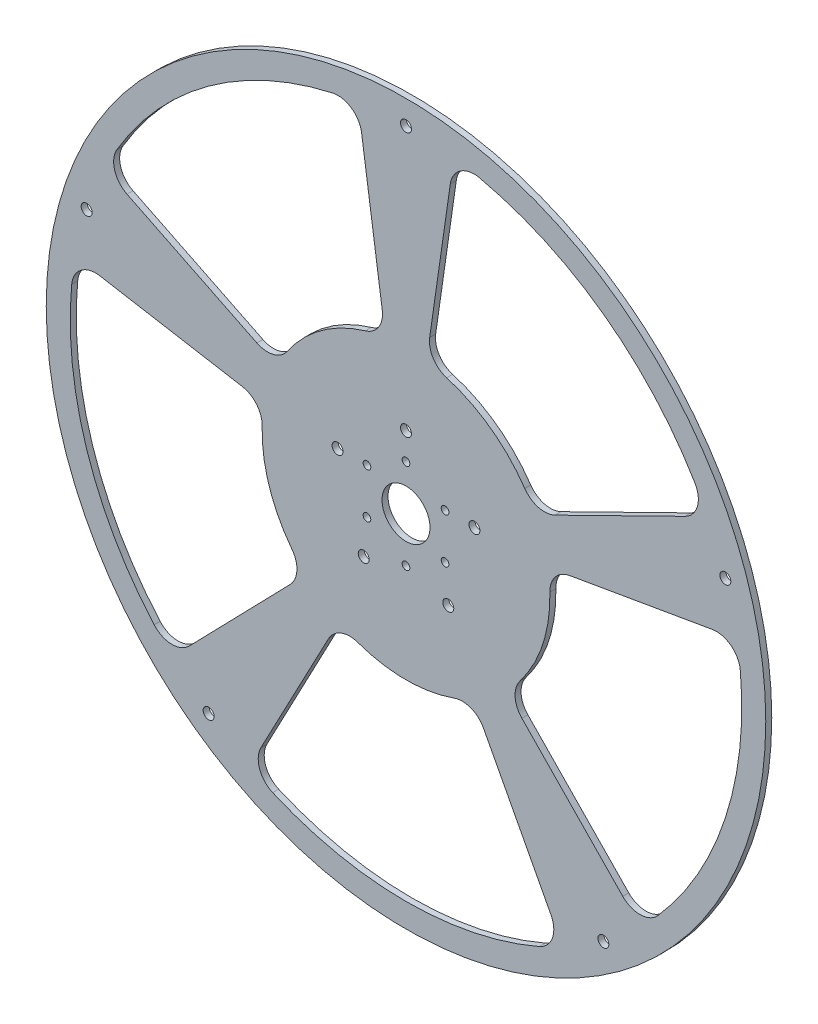
from build123d import *

# Parameters (mm, degrees)
SKETCH1_R           = 190.5
SKETCH1_R_2         = 12.7
SKETCH1_R_3         = 2.9
SKETCH1_R_4         = 2.032
BOSS_EXTRUDE3_DEPTH = 3.175
FILLET1_R           = 12.7
FILLET2_R           = 12.7
FILLET3_R           = 12.7


with BuildPart() as part:
    # Sketch1 → Boss-Extrude3 (new body)
    with BuildSketch(Plane.XY):
        Circle(SKETCH1_R)
        Circle(SKETCH1_R_2, mode=Mode.SUBTRACT)
        with Locations((-36.235253271, 11.773547486)):
            Circle(SKETCH1_R_3, mode=Mode.SUBTRACT)
        with Locations((-22.394618112, -30.823547486)):
            Circle(SKETCH1_R_3, mode=Mode.SUBTRACT)
        with Locations((22.394618112, -30.823547486)):
            Circle(SKETCH1_R_3, mode=Mode.SUBTRACT)
        with Locations((36.235253271, 11.773547486)):
            Circle(SKETCH1_R_3, mode=Mode.SUBTRACT)
        with Locations((0, 38.1)):
            Circle(SKETCH1_R_3, mode=Mode.SUBTRACT)
        with Locations((-169.097848597, 54.9432216)):
            Circle(SKETCH1_R_3, mode=Mode.SUBTRACT)
        with Locations((0, 177.8)):
            Circle(SKETCH1_R_3, mode=Mode.SUBTRACT)
        with Locations((169.097848597, 54.9432216)):
            Circle(SKETCH1_R_3, mode=Mode.SUBTRACT)
        with Locations((104.508217858, -143.8432216)):
            Circle(SKETCH1_R_3, mode=Mode.SUBTRACT)
        with Locations((-104.508217858, -143.8432216)):
            Circle(SKETCH1_R_3, mode=Mode.SUBTRACT)
        with Locations((-20.677222541, 11.938)):
            Circle(SKETCH1_R_4, mode=Mode.SUBTRACT)
        with Locations((0, 23.876)):
            Circle(SKETCH1_R_4, mode=Mode.SUBTRACT)
        with Locations((20.677222541, 11.938)):
            Circle(SKETCH1_R_4, mode=Mode.SUBTRACT)
        with Locations((20.677222541, -11.938)):
            Circle(SKETCH1_R_4, mode=Mode.SUBTRACT)
        with Locations((0, -23.876)):
            Circle(SKETCH1_R_4, mode=Mode.SUBTRACT)
        with Locations((-20.677222541, -11.938)):
            Circle(SKETCH1_R_4, mode=Mode.SUBTRACT)
        with BuildLine():
            Line((25.335121222, 175.985714286), (10.857909095, 75.42244898))
            ThreePointArc((10.857909095, 75.42244898), (44.789236225, 61.647094971), (68.375733143, 33.63330369))
            Line((68.375733143, 33.63330369), (159.543377334, 78.477708611))
            ThreePointArc((159.543377334, 78.477708611), (104.508217858, 143.8432216), (25.335121222, 175.985714286))
        make_face(mode=Mode.SUBTRACT)
        with BuildLine():
            Line((-25.4, 175.976362049), (-10.885714286, 75.418440878))
            ThreePointArc((-10.885714286, 75.418440878), (-44.800599154, 61.63883772), (-68.375733143, 33.63330369))
            Line((-68.375733143, 33.63330369), (-159.543377334, 78.477708611))
            ThreePointArc((-159.543377334, 78.477708611), (-104.53473136, 143.823954679), (-25.4, 175.976362049))
        make_face(mode=Mode.SUBTRACT)
        with BuildLine():
            Line((75.086290011, 12.980333294), (175.201343359, 30.287444352))
            ThreePointArc((175.201343359, 30.287444352), (169.097848597, -54.9432216), (123.938351095, -127.483823005))
            Line((123.938351095, -127.483823005), (53.116436183, -54.635924145))
            ThreePointArc((53.116436183, -54.635924145), (72.470506542, -23.547094971), (75.086290011, 12.980333294))
        make_face(mode=Mode.SUBTRACT)
        with BuildLine():
            Line((35.547970221, -67.400161819), (82.945263848, -157.267044244))
            ThreePointArc((82.945263848, -157.267044244), (0, -177.8), (-82.945263848, -157.267044244))
            Line((-82.945263848, -157.267044244), (-35.547970221, -67.400161819))
            ThreePointArc((-35.547970221, -67.400161819), (0, -76.2), (35.547970221, -67.400161819))
        make_face(mode=Mode.SUBTRACT)
        with BuildLine():
            Line((-175.201343359, 30.287444352), (-75.086290011, 12.980333294))
            ThreePointArc((-75.086290011, 12.980333294), (-72.470506542, -23.547094971), (-53.116436183, -54.635924145))
            Line((-53.116436183, -54.635924145), (-123.938351095, -127.483823005))
            ThreePointArc((-123.938351095, -127.483823005), (-169.097848597, -54.9432216), (-175.201343359, 30.287444352))
        make_face(mode=Mode.SUBTRACT)
    extrude(amount=BOSS_EXTRUDE3_DEPTH)

    # Fillet1
    fillet1_edges = [part.edges().sort_by_distance(p)[0] for p in [
        (-175.201343359, 30.287444352, 1.5875),
    ]]
    fillet(fillet1_edges, radius=FILLET1_R)

    # Fillet2
    fillet2_edges = [part.edges().sort_by_distance(p)[0] for p in [
        (-25.4, 175.976362049, 1.5875),
        (-159.543377334, 78.477708611, 1.5875),
        (-68.375733143, 33.63330369, 1.5875),
        (-10.885714286, 75.418440878, 1.5875),
        (75.086290011, 12.980333294, 1.5875),
        (53.116436183, -54.635924145, 1.5875),
        (123.938351095, -127.483823005, 1.5875),
        (175.201343359, 30.287444352, 1.5875),
        (35.547970221, -67.400161819, 1.5875),
        (10.857909095, 75.42244898, 1.5875),
        (68.375733143, 33.63330369, 1.5875),
        (159.543377334, 78.477708611, 1.5875),
        (25.335121222, 175.985714286, 1.5875),
    ]]
    fillet(fillet2_edges, radius=FILLET2_R)

    # Fillet3
    fillet3_edges = [part.edges().sort_by_distance(p)[0] for p in [
        (-35.547970221, -67.400161819, 1.5875),
        (-82.945263848, -157.267044244, 1.5875),
        (82.945263848, -157.267044244, 1.5875),
        (-123.938351095, -127.483823005, 1.5875),
        (-53.116436183, -54.635924145, 1.5875),
        (-75.086290011, 12.980333294, 1.5875),
    ]]
    fillet(fillet3_edges, radius=FILLET3_R)


solid = part.part
